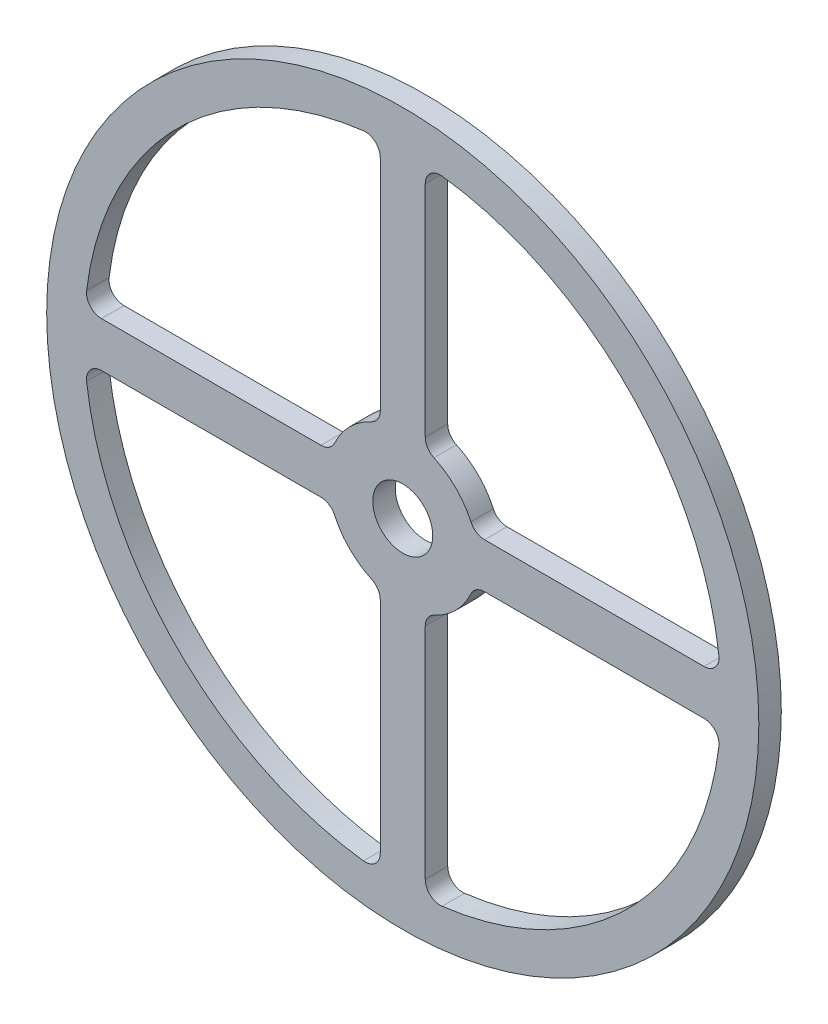
from build123d import *

# Parameters (mm, degrees)
SKETCH_1_R      = 47.5
SKETCH_1_R_2    = 4
EXTRUDE_1_DEPTH = 3
FILLET_1_R      = 2
FILLET_2_R      = 2
FILLET_4_R      = 2


with BuildPart() as part:
    # 草图1 → 凸台-拉伸1 (new body)
    with BuildSketch(Plane.XY):
        Circle(SKETCH_1_R)
        Circle(SKETCH_1_R_2, mode=Mode.SUBTRACT)
        with BuildLine():
            Line((3, 42.393985422), (3, 9.539392014))
            ThreePointArc((3, 9.539392014), (7.071067812, 7.071067812), (9.539392014, 3))
            Line((9.539392014, 3), (42.393985422, 3))
            ThreePointArc((42.393985422, 3), (30.0520382, 30.0520382), (3, 42.393985422))
        make_face(mode=Mode.SUBTRACT)
        with BuildLine():
            Line((-9.539392014, -3), (-42.393985422, -3))
            ThreePointArc((-42.393985422, -3), (-30.0520382, -30.0520382), (-3, -42.393985422))
            Line((-3, -42.393985422), (-3, -9.539392014))
            ThreePointArc((-3, -9.539392014), (-7.071067812, -7.071067812), (-9.539392014, -3))
        make_face(mode=Mode.SUBTRACT)
        with BuildLine():
            Line((9.539392014, -3), (42.393985422, -3))
            ThreePointArc((42.393985422, -3), (30.0520382, -30.0520382), (3, -42.393985422))
            Line((3, -42.393985422), (3, -9.539392014))
            ThreePointArc((3, -9.539392014), (7.071067812, -7.071067812), (9.539392014, -3))
        make_face(mode=Mode.SUBTRACT)
        with BuildLine():
            Line((-3, 9.539392014), (-3, 42.393985422))
            ThreePointArc((-3, 42.393985422), (-30.0520382, 30.0520382), (-42.393985422, 3))
            Line((-42.393985422, 3), (-9.539392014, 3))
            ThreePointArc((-9.539392014, 3), (-7.071067812, 7.071067812), (-3, 9.539392014))
        make_face(mode=Mode.SUBTRACT)
    extrude(amount=EXTRUDE_1_DEPTH)

    # 圆角1
    fillet_1_edges = [part.edges().sort_by_distance(p)[0] for p in [
        (3, 42.393985422, 1.5),
    ]]
    fillet(fillet_1_edges, radius=FILLET_1_R)

    # 圆角2
    fillet_2_edges = [part.edges().sort_by_distance(p)[0] for p in [
        (42.393985422, 3, 1.5),
        (3, -42.393985422, 1.5),
        (42.393985422, -3, 1.5),
        (-42.393985422, -3, 1.5),
        (-3, -42.393985422, 1.5),
        (-3, 42.393985422, 1.5),
        (-42.393985422, 3, 1.5),
    ]]
    fillet(fillet_2_edges, radius=FILLET_2_R)

    # 圆角4
    fillet_4_edges = [part.edges().sort_by_distance(p)[0] for p in [
        (3, 9.539392014, 1.5),
        (9.539392014, 3, 1.5),
        (9.539392014, -3, 1.5),
        (3, -9.539392014, 1.5),
        (-3, -9.539392014, 1.5),
        (-9.539392014, -3, 1.5),
        (-9.539392014, 3, 1.5),
        (-3, 9.539392014, 1.5),
    ]]
    fillet(fillet_4_edges, radius=FILLET_4_R)


solid = part.part
